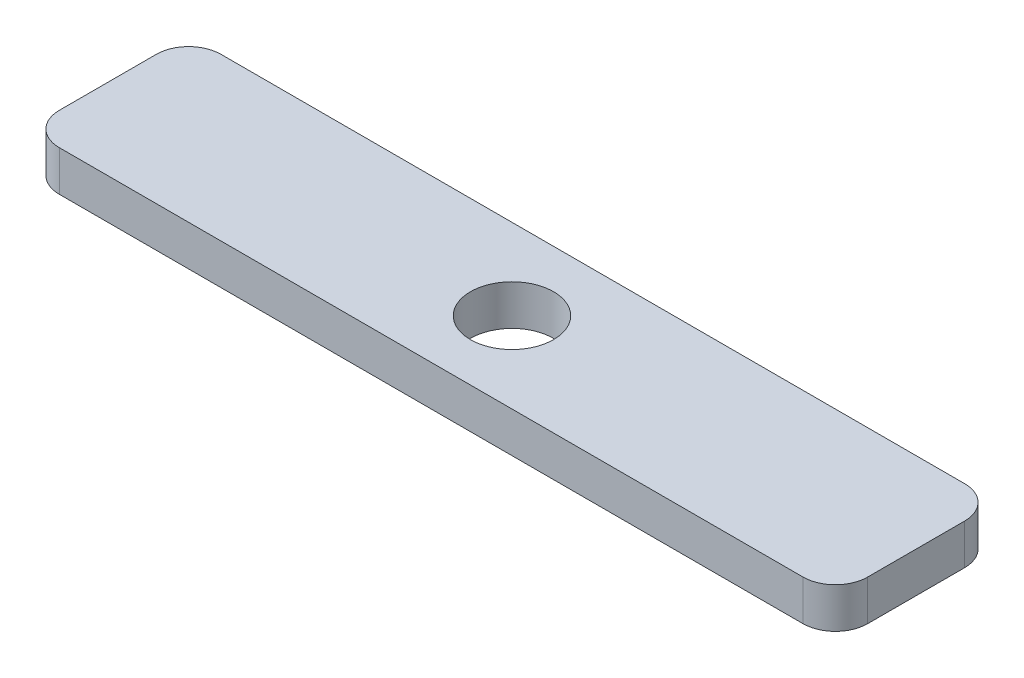
from build123d import *

# Parameters (mm, degrees)
SKETCH1_W           = 63.5
SKETCH1_H           = 12.7
SKETCH1_R           = 3.2639
BOSS_EXTRUDE1_DEPTH = 3.175
FILLET1_R           = 2.54


with BuildPart() as part:
    # Sketch1 → Boss-Extrude1 (new body)
    with BuildSketch(Plane(origin=(0, 0, 0), x_dir=(1, 0, 0), z_dir=(0, 1, 0))):
        Rectangle(SKETCH1_W, SKETCH1_H)
        with Locations(Location((0, 0, 0), (0, 0, 270))):
            Circle(SKETCH1_R, mode=Mode.SUBTRACT)
    extrude(amount=BOSS_EXTRUDE1_DEPTH)

    # Fillet1
    fillet1_edges = [part.edges().sort_by_distance(p)[0] for p in [
        (31.75, 1.5875, 6.35),
        (-31.75, 1.5875, 6.35),
        (-31.75, 1.5875, -6.35),
        (31.75, 1.5875, -6.35),
    ]]
    fillet(fillet1_edges, radius=FILLET1_R)


solid = part.part
